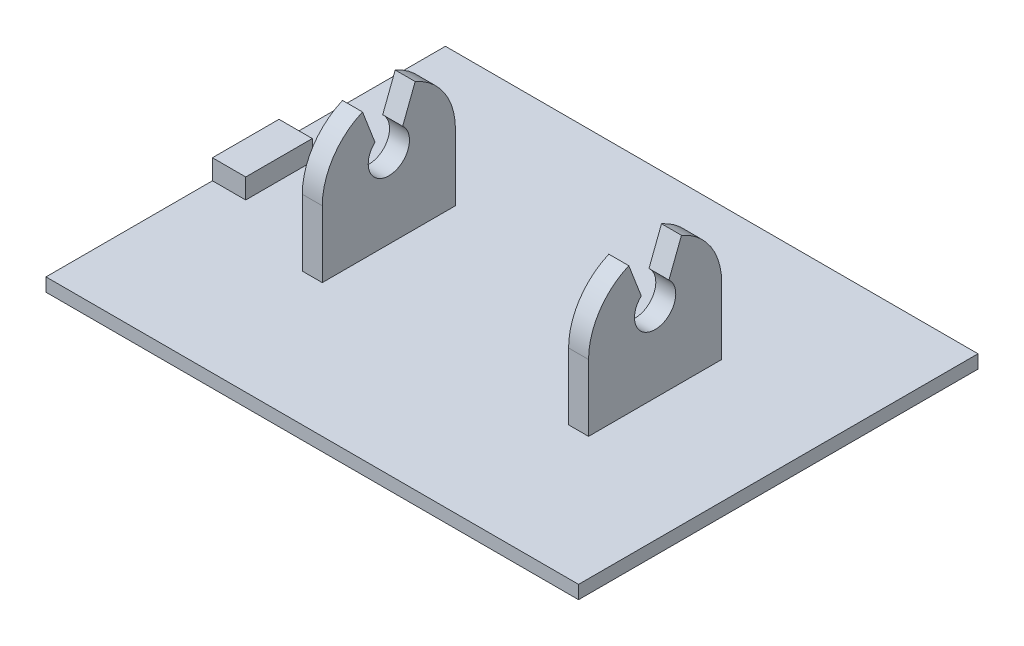
from build123d import *

# Parameters (mm, degrees)
SKETCH1_W                   = 80
SKETCH1_H                   = 60
BOSS_EXTRUDE1_DEPTH         = 2
SKETCH2_W                   = 3
SKETCH2_H                   = 20
BOSS_EXTRUDE2_DEPTH         = 20
CUT_EXTRUDE1_REACH          = 71.327
SKETCH3_R                   = 3.1
FILLET1_RADIUS              = 10
FILLET1_LENGTH              = 3
CUT_EXTRUDE2_REACH          = 73.877
FILLET1_OF_MIRROR1_2_RADIUS = 10
FILLET1_OF_MIRROR1_2_LENGTH = 3
SKETCH5_W                   = 5
SKETCH5_H                   = 10
BOSS_EXTRUDE3_DEPTH         = 3


with BuildPart() as part:
    # Sketch1 → Boss-Extrude1 (new body)
    with BuildSketch(Plane(origin=(0, 0, 0), x_dir=(1, 0, 0), z_dir=(0, 1, 0))):
        Rectangle(SKETCH1_W, SKETCH1_H)
    extrude(amount=BOSS_EXTRUDE1_DEPTH)

    # Sketch2 → Boss-Extrude2 (add)
    with BuildSketch(Plane(origin=(0, 2, 0), x_dir=(1, 0, 0), z_dir=(0, 1, 0))):
        with Locations((-20, 0)):
            Rectangle(SKETCH2_W, SKETCH2_H)
    boss_extrude2 = extrude(amount=BOSS_EXTRUDE2_DEPTH)

    # Sketch3 → Cut-Extrude1 (cut, up to next)
    with BuildSketch(Plane(origin=(-18.5, 0, 0), x_dir=(0, 0, -1), z_dir=(1, 0, 0)), mode=Mode.PRIVATE) as cut_extrude1_sk1:
        with Locations((0, 14)):
            Circle(SKETCH3_R)
    cut_extrude1_tool1 = extrude(cut_extrude1_sk1.sketch, amount=-CUT_EXTRUDE1_REACH, mode=Mode.PRIVATE) & part.part
    cut_extrude1 = cut_extrude1_tool1.solids().sort_by_distance((-18.5, 14, 0))[0]
    add(cut_extrude1, mode=Mode.SUBTRACT)

    # Fillet1: full round fillet: the end face becomes a half cylinder, R = half its width
    fillet1_face = Plane((-20, 22, 0), x_dir=(-1, 0, 0), z_dir=(0, 1, 0))  # on the end face: x along it, z out of the body
    fillet1_slab = fillet1_face.offset(-FILLET1_RADIUS / 2) * Box(FILLET1_LENGTH, 2 * FILLET1_RADIUS, FILLET1_RADIUS, mode=Mode.PRIVATE)  # the body's end, R deep
    fillet1_round = Plane((-20, 12, 0), x_dir=(0, 1, 0), z_dir=(-1, 0, 0)) * Cylinder(FILLET1_RADIUS, FILLET1_LENGTH, mode=Mode.PRIVATE)  # its axis R under the face
    add(fillet1_slab - fillet1_round, mode=Mode.SUBTRACT)

    # Sketch4 → Cut-Extrude2 (cut, up to next)
    with BuildSketch(Plane.ZY.offset(21.5), mode=Mode.PRIVATE) as cut_extrude2_sk1:
        Polygon((0, 10.9), (5, 23.9), (-5, 23.9), align=None)
    cut_extrude2_tool1 = extrude(cut_extrude2_sk1.sketch, amount=-CUT_EXTRUDE2_REACH, mode=Mode.PRIVATE) & part.part
    cut_extrude2 = cut_extrude2_tool1.solids().sort_by_distance((-21.5, 19.566667, 0))[0]
    add(cut_extrude2, mode=Mode.SUBTRACT)

    # Mirror1: Boss-Extrude2, Cut-Extrude1, Cut-Extrude2 across plane
    add(boss_extrude2.mirror(Plane(origin=(0, 0, 0), x_dir=(0, 0, 1), z_dir=(1, 0, 0))))
    add(cut_extrude1.mirror(Plane(origin=(0, 0, 0), x_dir=(0, 0, 1), z_dir=(1, 0, 0))), mode=Mode.SUBTRACT)
    add(cut_extrude2.mirror(Plane(origin=(0, 0, 0), x_dir=(0, 0, 1), z_dir=(1, 0, 0))), mode=Mode.SUBTRACT)

    # Fillet1 of Mirror1 2: full round fillet: the end face becomes a half cylinder, R = half its width
    fillet1_of_mirror1_2_face = Plane((20, 22, 0), x_dir=(1, 0, 0), z_dir=(0, 1, 0))  # on the end face: x along it, z out of the body
    fillet1_of_mirror1_2_slab = fillet1_of_mirror1_2_face.offset(-FILLET1_OF_MIRROR1_2_RADIUS / 2) * Box(FILLET1_OF_MIRROR1_2_LENGTH, 2 * FILLET1_OF_MIRROR1_2_RADIUS, FILLET1_OF_MIRROR1_2_RADIUS, mode=Mode.PRIVATE)  # the body's end, R deep
    fillet1_of_mirror1_2_round = Plane((20, 12, 0), x_dir=(0, 1, 0), z_dir=(1, 0, 0)) * Cylinder(FILLET1_OF_MIRROR1_2_RADIUS, FILLET1_OF_MIRROR1_2_LENGTH, mode=Mode.PRIVATE)  # its axis R under the face
    add(fillet1_of_mirror1_2_slab - fillet1_of_mirror1_2_round, mode=Mode.SUBTRACT)

    # Sketch5 → Boss-Extrude3 (add)
    with BuildSketch(Plane(origin=(0, 2, 0), x_dir=(1, 0, 0), z_dir=(0, 1, 0))):
        with Locations((-37.5, 0)):
            Rectangle(SKETCH5_W, SKETCH5_H)
    extrude(amount=BOSS_EXTRUDE3_DEPTH)


solid = part.part
